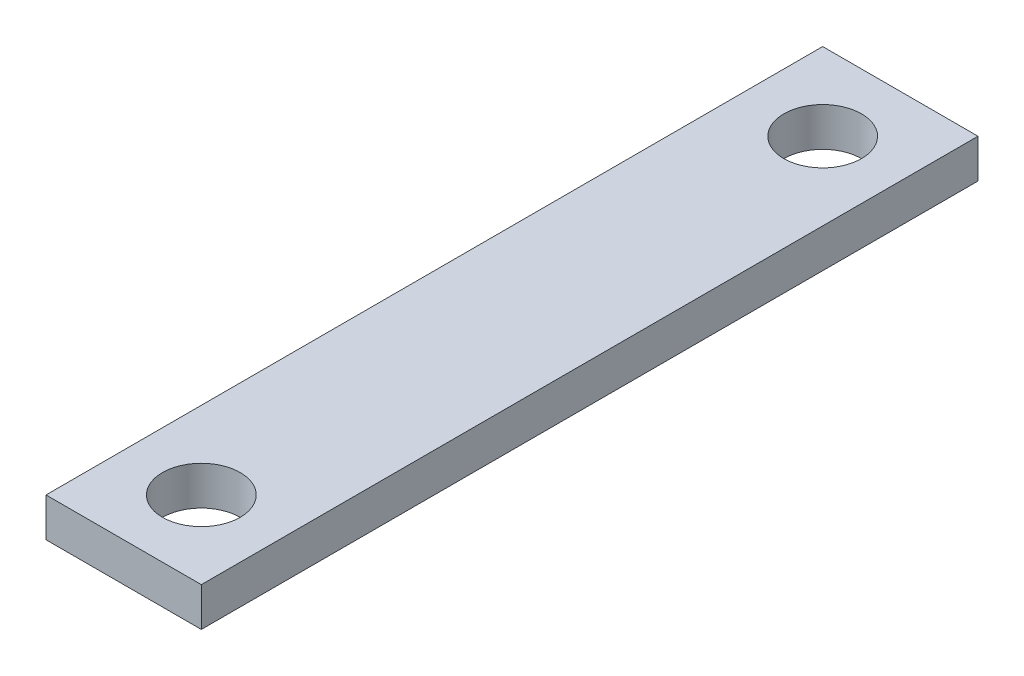
from build123d import *

# Parameters (mm, degrees)
SKETCH1_W           = 12.7
SKETCH1_H           = 63.5
SKETCH1_R           = 3.175
BOSS_EXTRUDE1_DEPTH = 3.175


with BuildPart() as part:
    # Sketch1 → Boss-Extrude1 (new body)
    with BuildSketch(Plane(origin=(0, 0, 0), x_dir=(1, 0, 0), z_dir=(0, 1, 0))):
        with Locations((6.35, 31.75)):
            Rectangle(SKETCH1_W, SKETCH1_H)
        with Locations(Location((6.35, 57.15, 0), (0, 0, 270))):
            Circle(SKETCH1_R, mode=Mode.SUBTRACT)
        with Locations(Location((6.35, 6.35, 0), (0, 0, 270))):
            Circle(SKETCH1_R, mode=Mode.SUBTRACT)
    extrude(amount=BOSS_EXTRUDE1_DEPTH)


solid = part.part
